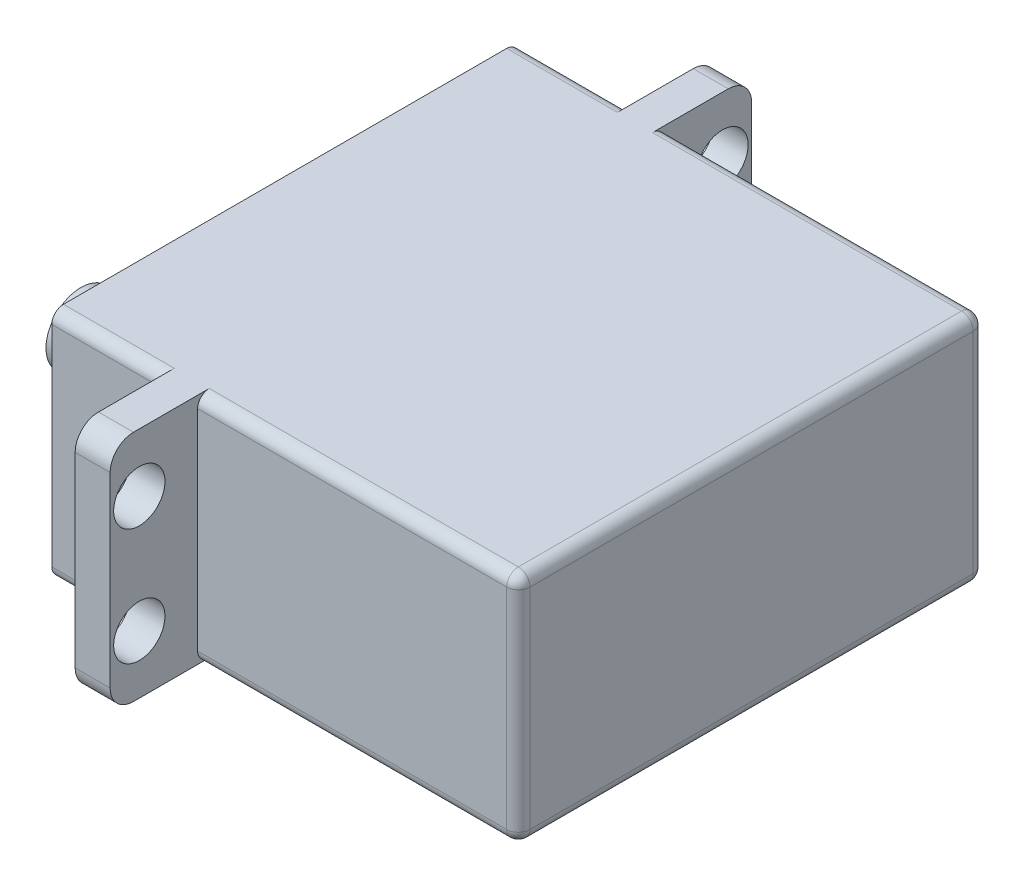
from build123d import *

# Parameters (mm, degrees)
EXTRUDE_1_DEPTH = 27.5
SKETCH_2_R      = 2.2
EXTRUDE_2_DEPTH = 3
SKETCH_3_W      = 40
SKETCH_3_H      = 20
EXTRUDE_3_DEPTH = 40
SKETCH_4_R      = 3
EXTRUDE_4_DEPTH = 7.5
FILLET_1_R      = 1


with BuildPart() as part:
    # ｽｹｯﾁ1 → ﾎﾞｽ - 押し出し1 (new body)
    with BuildSketch(Plane(origin=(0, 0, 0), x_dir=(0, 0, -1), z_dir=(1, 0, 0))):
        Polygon((40, 0), (0, 0), (0, -10), (0, -20), (40, -20), align=None)
    extrude(amount=EXTRUDE_1_DEPTH)

    # ｽｹｯﾁ2 → ﾎﾞｽ - 押し出し2 (add)
    with BuildSketch(Plane.ZY):
        with BuildLine():
            Line((5.5, 0), (-45.5, 0))
            ThreePointArc((-45.5, 0), (-46.914213562, -0.585786438), (-47.5, -2))
            Line((-47.5, -2), (-47.5, -18))
            ThreePointArc((-47.5, -18), (-46.914213562, -19.414213562), (-45.5, -20))
            Line((-45.5, -20), (5.5, -20))
            ThreePointArc((5.5, -20), (6.914213562, -19.414213562), (7.5, -18))
            Line((7.5, -18), (7.5, -2))
            ThreePointArc((7.5, -2), (6.914213562, -0.585786438), (5.5, 0))
        make_face()
        with Locations((-45, -5)):
            Circle(SKETCH_2_R, mode=Mode.SUBTRACT)
        with Locations(Location((5, -5, 0), (0, 0, 180))):
            Circle(SKETCH_2_R, mode=Mode.SUBTRACT)
        with Locations((5, -15)):
            Circle(SKETCH_2_R, mode=Mode.SUBTRACT)
        with Locations(Location((-45, -15, 0), (0, 0, 180))):
            Circle(SKETCH_2_R, mode=Mode.SUBTRACT)
    extrude(amount=EXTRUDE_2_DEPTH)

    # ｽｹｯﾁ3 → ﾎﾞｽ - 押し出し3 (add)
    with BuildSketch(Plane(origin=(27.5, 0, 0), x_dir=(0, 0, -1), z_dir=(1, 0, 0))):
        with Locations((20, -10)):
            Rectangle(SKETCH_3_W, SKETCH_3_H)
    extrude(amount=-EXTRUDE_3_DEPTH)

    # ｽｹｯﾁ4 → ﾎﾞｽ - 押し出し4 (add)
    with BuildSketch(Plane.ZY.offset(12.5)):
        with Locations(Location((-10, -10, 0), (0, 0, 180))):
            Circle(SKETCH_4_R)
    extrude(amount=EXTRUDE_4_DEPTH)

    # ﾌｨﾚｯﾄ1
    fillet_1_edges = [part.edges().sort_by_distance(p)[0] for p in [
        (27.5, 0, -20),
        (27.5, -10, 0),
        (27.5, -20, -20),
        (-7.75, -20, 0),
        (-7.75, 0, 0),
        (-7.75, 0, -40),
        (-7.75, -20, -40),
        (27.5, -10, -40),
        (13.75, -20, -40),
        (13.75, -20, 0),
        (13.75, 0, 0),
        (13.75, 0, -40),
    ]]
    fillet(fillet_1_edges, radius=FILLET_1_R)


solid = part.part
